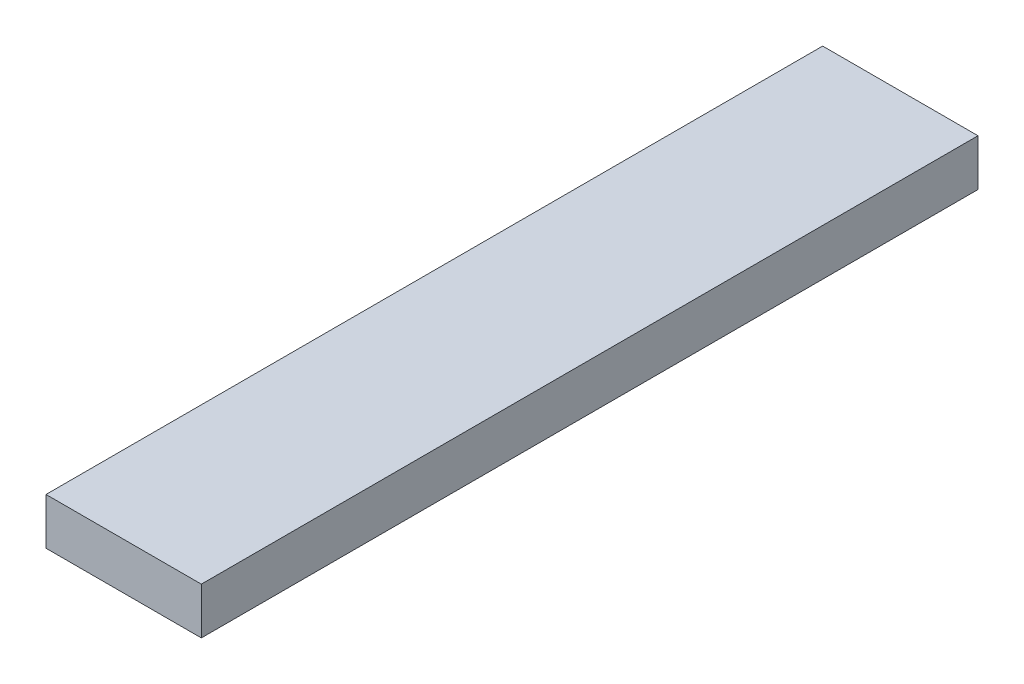
from build123d import *

# Parameters (mm, degrees)
SKETCH1_W           = 10
SKETCH1_H           = 50
BOSS_EXTRUDE1_DEPTH = 3


with BuildPart() as part:
    # Sketch1 → Boss-Extrude1 (new body)
    with BuildSketch(Plane(origin=(0, 0, 0), x_dir=(1, 0, 0), z_dir=(0, 1, 0))):
        with Locations((5, 25)):
            Rectangle(SKETCH1_W, SKETCH1_H)
    extrude(amount=BOSS_EXTRUDE1_DEPTH)


solid = part.part
